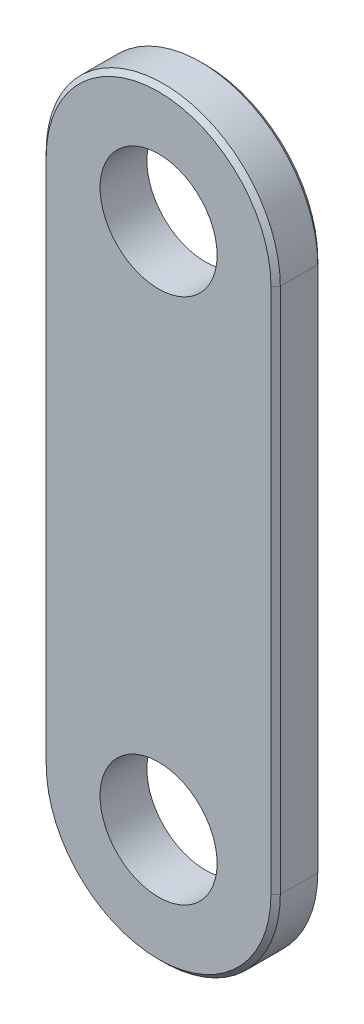
from build123d import *

# Parameters (mm, degrees)
BOSS_EXTRUDE1_DEPTH = 20
SKETCH1_3_R         = 25
CUT_EXTRUDE1_DEPTH  = 149
CHAMFER1_SIZE       = 2


with BuildPart() as part:
    # Sketch1 → Boss-Extrude1 (new body)
    with BuildSketch(Plane.XY):
        with BuildLine():
            Line((-50, 111.475422903), (-50, -113.524577097))
            ThreePointArc((-50, -113.524577097), (0, -163.524577097), (50, -113.524577097))
            Line((50, -113.524577097), (50, 111.475422903))
            ThreePointArc((50, 111.475422903), (0, 161.475422903), (-50, 111.475422903))
        make_face()
    extrude(amount=BOSS_EXTRUDE1_DEPTH)

    # Sketch1<3> → Cut-Extrude1 (cut)
    with BuildSketch(Plane.XY):
        with Locations((0, 111.475422903)):
            Circle(SKETCH1_3_R)
        with Locations((0, -113.524577097)):
            Circle(SKETCH1_3_R)
    extrude(amount=CUT_EXTRUDE1_DEPTH, mode=Mode.SUBTRACT)

    # Chamfer1
    chamfer1_edges = [part.edges().sort_by_distance(p)[0] for p in [
        (0, -163.524577097, 0),
        (-50, -1.024577097, 0),
        (0, 161.475422903, 0),
        (50, -1.024577097, 0),
        (0, -163.524577097, 20),
        (-50, -1.024577097, 20),
        (0, 161.475422903, 20),
        (50, -1.024577097, 20),
    ]]
    chamfer(chamfer1_edges, length=CHAMFER1_SIZE)


solid = part.part
